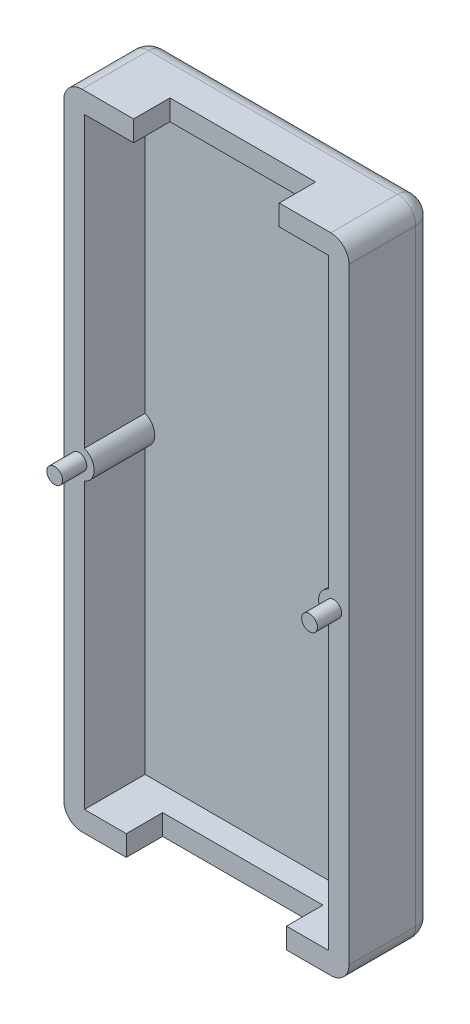
from build123d import *

# Parameters (mm, degrees)
SKETCH_1_W          = 23.5
SKETCH_1_H          = 53
SKETCH_1_W_2        = 20.1
SKETCH_1_H_2        = 49.6
EXTRUDE_1_DEPTH     = 7
SKETCH_1_5_R        = 1.25
EXTRUDE_2_DEPTH     = 7
EXTRUDE_3_DEPTH     = 2
SKETCH_2_W          = 13.2
SKETCH_2_H          = 1.7
SKETCH_2_W_2        = 12
CUT_EXTRUDE_1_DEPTH = 3
SKETCH_2_3_R        = 0.65
EXTRUDE_4_DEPTH     = 2
FILLET_1_R          = 1.5


with BuildPart() as part:
    # 草图1 → 凸台-拉伸1 (new body)
    with BuildSketch(Plane.XY):
        with Locations((11.75, -26.5)):
            Rectangle(SKETCH_1_W, SKETCH_1_H)
        with Locations((11.75, -26.5)):
            Rectangle(SKETCH_1_W_2, SKETCH_1_H_2, mode=Mode.SUBTRACT)
    extrude(amount=EXTRUDE_1_DEPTH)

    # 草图1<5> → 凸台-拉伸2 (add)
    with BuildSketch(Plane.XY):
        with Locations((1.25, -26.7)):
            Circle(SKETCH_1_5_R)
        with Locations((22.25, -26.7)):
            Circle(SKETCH_1_5_R)
    extrude(amount=EXTRUDE_2_DEPTH)

    # 草图1<6> → 凸台-拉伸3 (add)
    with BuildSketch(Plane.XY):
        with BuildLine():
            Line((1.7, -1.7), (1.7, -25.533809621))
            ThreePointArc((1.7, -25.533809621), (2.280776406, -25.992893219), (2.5, -26.7))
            ThreePointArc((2.5, -26.7), (2.280776406, -27.407106781), (1.7, -27.866190379))
            Line((1.7, -27.866190379), (1.7, -51.3))
            Line((1.7, -51.3), (21.8, -51.3))
            Line((21.8, -51.3), (21.8, -27.866190379))
            ThreePointArc((21.8, -27.866190379), (21, -26.7), (21.8, -25.533809621))
            Line((21.8, -25.533809621), (21.8, -1.7))
            Line((21.8, -1.7), (1.7, -1.7))
        make_face()
    extrude(amount=EXTRUDE_3_DEPTH)

    # 草图2 → 切除-拉伸1 (cut)
    with BuildSketch(Plane.XY.offset(7)):
        with Locations((11.75, -52.15)):
            Rectangle(SKETCH_2_W, SKETCH_2_H)
        with Locations((11.75, -0.85)):
            Rectangle(SKETCH_2_W_2, SKETCH_2_H)
    extrude(amount=-CUT_EXTRUDE_1_DEPTH, mode=Mode.SUBTRACT)

    # 草图2<3> → 凸台-拉伸4 (add)
    with BuildSketch(Plane.XY.offset(7)):
        with Locations((1.25, -26.7)):
            Circle(SKETCH_2_3_R)
        with Locations((22.25, -26.7)):
            Circle(SKETCH_2_3_R)
    extrude(amount=EXTRUDE_4_DEPTH)

    # 圆角1
    fillet_1_edges = [part.edges().sort_by_distance(p)[0] for p in [
        (11.75, 0, 0),
        (0, -26.5, 0),
        (11.75, -53, 0),
        (23.5, -26.5, 0),
        (0, 0, 3.5),
        (23.5, 0, 3.5),
        (23.5, -53, 3.5),
        (0, -53, 3.5),
    ]]
    fillet(fillet_1_edges, radius=FILLET_1_R)


solid = part.part
